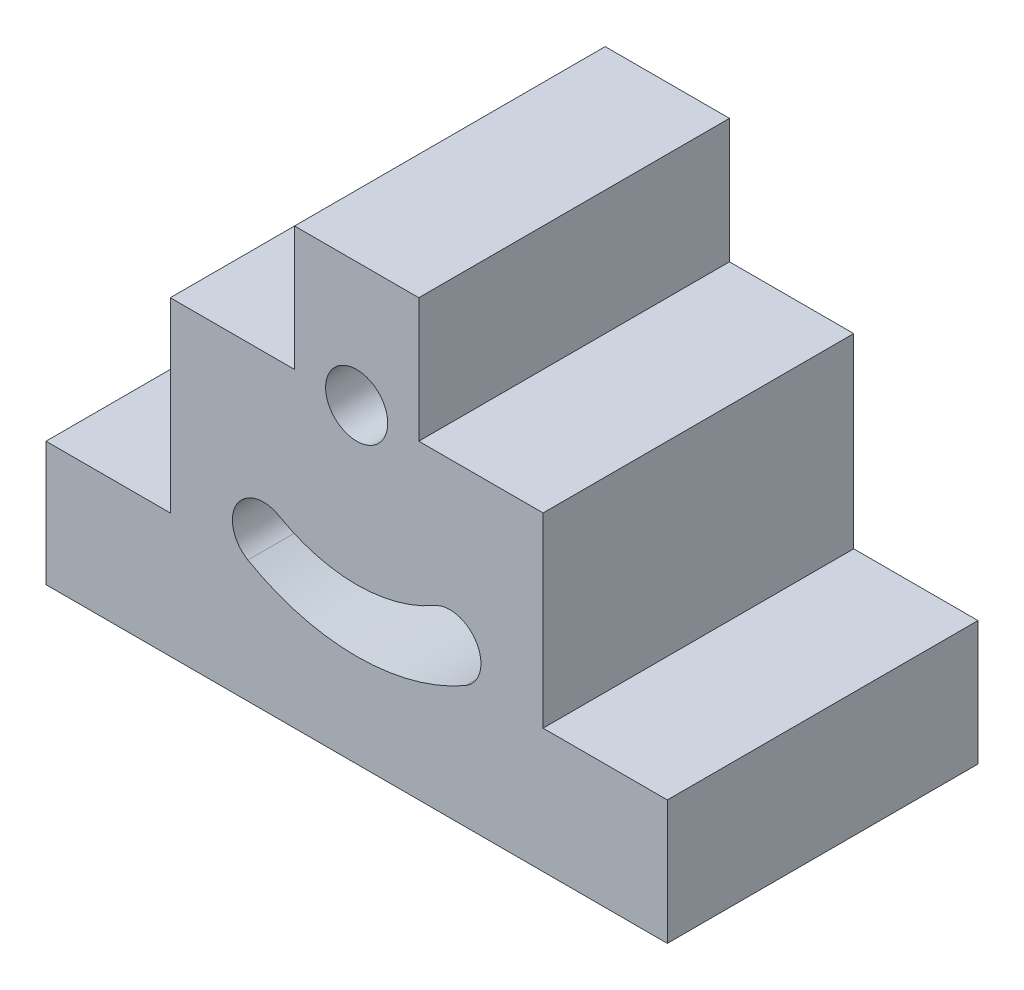
from build123d import *

# Parameters (mm, degrees)
SKETCH2_R           = 0.5
BOSS_EXTRUDE1_DEPTH = 2.5


with BuildPart() as part:
    # Sketch2 → Boss-Extrude1 (new, symmetric)
    with BuildSketch(Plane.XY):
        Polygon((-5, 0), (5, 0), (5, 2), (3, 2), (3, 5), (1, 5), (1, 7), (-1, 7), (-1, 5), (-3, 5), (-3, 2), (-5, 2), align=None)
        with Locations((0, 5)):
            Circle(SKETCH2_R, mode=Mode.SUBTRACT)
        with BuildLine():
            ThreePointArc((-1.75, 1.968911087), (0, 1.5), (1.75, 1.968911087))
            ThreePointArc((1.75, 1.968911087), (1.933012702, 2.651923789), (1.25, 2.834936491))
            ThreePointArc((1.25, 2.834936491), (0, 2.5), (-1.25, 2.834936491))
            ThreePointArc((-1.25, 2.834936491), (-1.933012702, 2.651923789), (-1.75, 1.968911087))
        make_face(mode=Mode.SUBTRACT)
    extrude(amount=BOSS_EXTRUDE1_DEPTH, both=True)


solid = part.part
